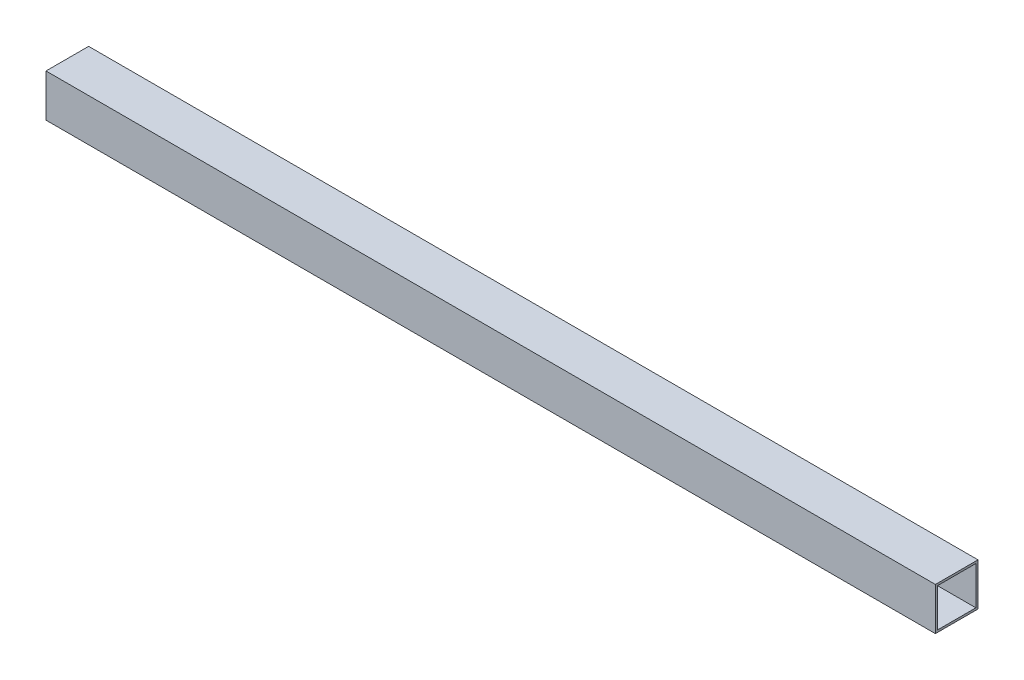
from build123d import *

# Parameters (mm, degrees)
SKETCH1_W           = 530
SKETCH1_H           = 25.4
BOSS_EXTRUDE1_DEPTH = 25.4
SKETCH2_W           = 22.86
SKETCH2_H           = 22.86
CUT_EXTRUDE1_DEPTH  = 532.215888317


with BuildPart() as part:
    # Sketch1 → Boss-Extrude1 (new body)
    with BuildSketch(Plane(origin=(0, 0, 0), x_dir=(1, 0, 0), z_dir=(0, 1, 0))):
        with Locations((265, 12.7)):
            Rectangle(SKETCH1_W, SKETCH1_H)
    extrude(amount=BOSS_EXTRUDE1_DEPTH)

    # Sketch2 → Cut-Extrude1 (cut, through all)
    with BuildSketch(Plane(origin=(530, 0, 0), x_dir=(0, 0, -1), z_dir=(1, 0, 0))):
        with Locations((12.7, 12.7)):
            Rectangle(SKETCH2_W, SKETCH2_H)
    extrude(amount=-CUT_EXTRUDE1_DEPTH, mode=Mode.SUBTRACT)


solid = part.part
